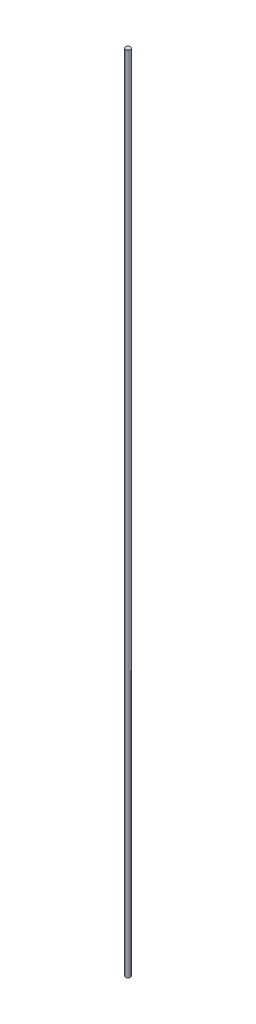
from build123d import *

# Parameters (mm, degrees)
SKETCH1_R           = 12.5
BOSS_EXTRUDE1_DEPTH = 4033


with BuildPart() as part:
    # Sketch1 → Boss-Extrude1 (new body)
    with BuildSketch(Plane(origin=(0, 0, 0), x_dir=(1, 0, 0), z_dir=(0, 1, 0))):
        with Locations(Location((0, 0, 0), (0, 0, 270))):
            Circle(SKETCH1_R)
    extrude(amount=BOSS_EXTRUDE1_DEPTH)


solid = part.part
